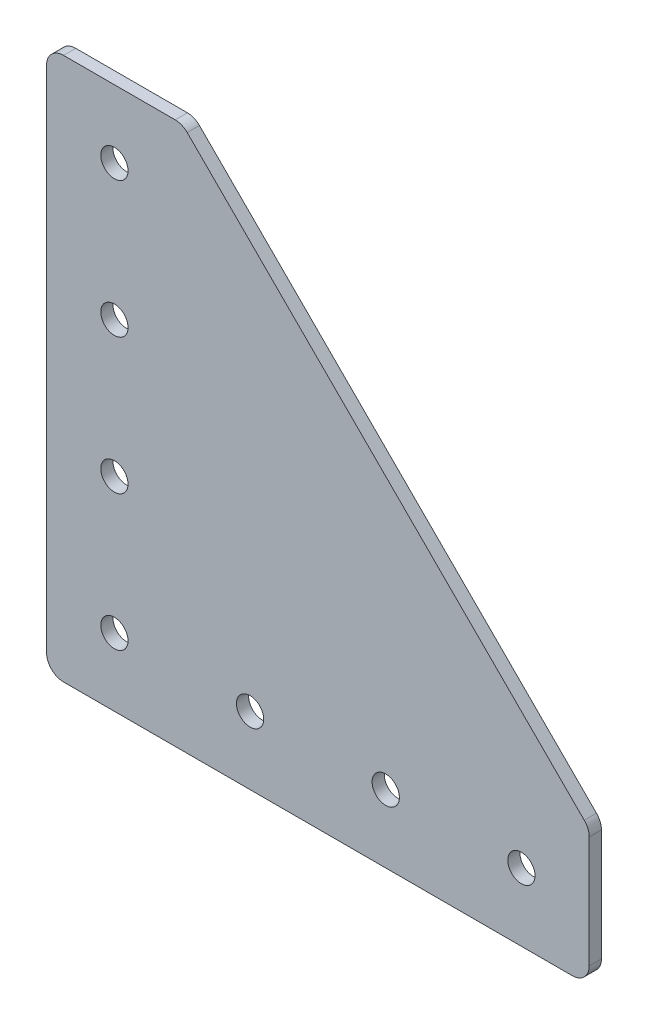
from build123d import *

# Parameters (mm, degrees)
SKETCH1_R           = 2.5527
BOSS_EXTRUDE1_DEPTH = 1.143
FILLET1_R           = 3.175


with BuildPart() as part:
    # Sketch1 → Boss-Extrude1 (new, symmetric)
    with BuildSketch(Plane.XY):
        Polygon((43.046315789, -67.510526316), (43.046315789, -42.110526316), (-33.153684211, 34.089473684), (-58.553684211, 34.089473684), (-58.553684211, -67.510526316), align=None)
        with Locations((-45.853684211, 21.389473684)):
            Circle(SKETCH1_R, mode=Mode.SUBTRACT)
        with Locations((-45.853684211, -4.010526316)):
            Circle(SKETCH1_R, mode=Mode.SUBTRACT)
        with Locations((-45.853684211, -29.410526316)):
            Circle(SKETCH1_R, mode=Mode.SUBTRACT)
        with Locations((-45.853684211, -54.810526316)):
            Circle(SKETCH1_R, mode=Mode.SUBTRACT)
        with Locations((-20.453684211, -54.810526316)):
            Circle(SKETCH1_R, mode=Mode.SUBTRACT)
        with Locations((4.946315789, -54.810526316)):
            Circle(SKETCH1_R, mode=Mode.SUBTRACT)
        with Locations((30.346315789, -54.810526316)):
            Circle(SKETCH1_R, mode=Mode.SUBTRACT)
    extrude(amount=BOSS_EXTRUDE1_DEPTH, both=True)

    # Fillet1
    fillet1_edges = [part.edges().sort_by_distance(p)[0] for p in [
        (-58.553684211, 34.089473684, 0),
        (-33.153684211, 34.089473684, 0),
        (43.046315789, -42.110526316, 0),
        (43.046315789, -67.510526316, 0),
        (-58.553684211, -67.510526316, 0),
    ]]
    fillet(fillet1_edges, radius=FILLET1_R)


solid = part.part
